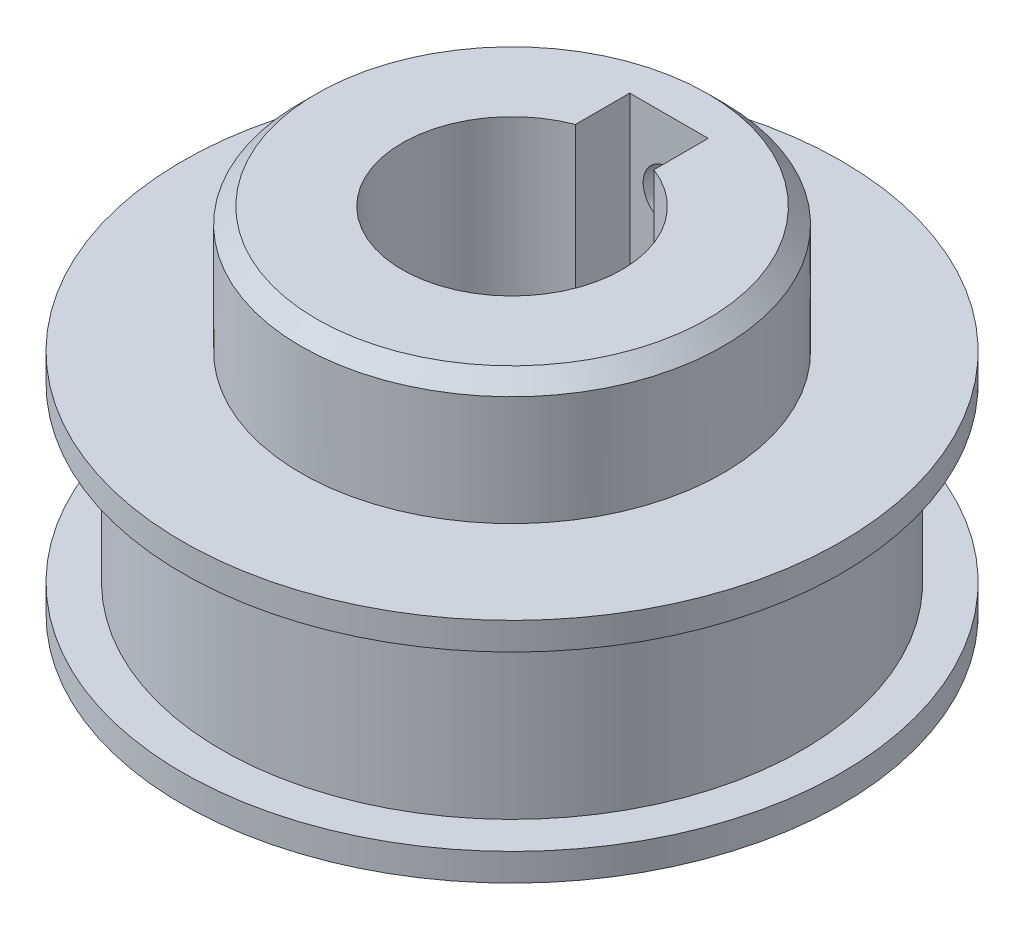
from build123d import *

# Parameters (mm, degrees)
SMUSSO1_SIZE             = 1
SCHIZZO2_R               = 6
TAGLIO_ESTRUSIONE1_DEPTH = 38.259227045
SCHIZZO3_R               = 1.65
TAGLIO_ESTRUSIONE2_DEPTH = 32.75787304
SCHIZZO4_R               = 7
TAGLIO_ESTRUSIONE3_DEPTH = 38.259227106
SCHIZZO5_W               = 5
SCHIZZO5_H               = 6
TAGLIO_ESTRUSIONE4_DEPTH = 38.259227106


with BuildPart() as part:
    # Schizzo1 → Rivoluzione1 (revolve)
    with BuildSketch(Plane.XY, mode=Mode.PRIVATE) as rivoluzione1_sk:
        Polygon((0, 11.25), (13.45, 11.25), (13.45, 3.25), (21, 3.25), (21, 1.5), (18.5, 1.5), (18.5, -9.5), (21, -9.5), (21, -11.25), (0, -11.25), align=None)
    revolve(rivoluzione1_sk.sketch.rotate(Axis((0, -12.375, 0), (0, 1, 0)), 90), axis=Axis((0, -12.375, 0), (0, 1, 0)))

    # Smusso1
    smusso1_edges = [part.edges().sort_by_distance(p)[0] for p in [
        (0, 11.25, 13.45),
    ]]
    chamfer(smusso1_edges, length=SMUSSO1_SIZE)

    # Schizzo2 → Taglio-Estrusione1 (cut, through all)
    with BuildSketch(Plane(origin=(0, 11.25, 0), x_dir=(1, 0, 0), z_dir=(0, 1, 0))):
        with Locations(Location((0, 0, 0), (0, 0, 270))):
            Circle(SCHIZZO2_R)
    extrude(amount=-TAGLIO_ESTRUSIONE1_DEPTH, mode=Mode.SUBTRACT)

    # Schizzo3 → Taglio-Estrusione2 (cut, through all)
    with BuildSketch(Plane.XY):
        with Locations((0, 6.75)):
            Circle(SCHIZZO3_R)
    extrude(amount=-TAGLIO_ESTRUSIONE2_DEPTH, mode=Mode.SUBTRACT)

    # Schizzo4 → Taglio-Estrusione3 (cut, through all)
    with BuildSketch(Plane(origin=(0, 11.25, 0), x_dir=(1, 0, 0), z_dir=(0, 1, 0))):
        with Locations(Location((0, 0, 0), (0, 0, 270))):
            Circle(SCHIZZO4_R)
    extrude(amount=-TAGLIO_ESTRUSIONE3_DEPTH, mode=Mode.SUBTRACT)

    # Schizzo5 → Taglio-Estrusione4 (cut, through all)
    with BuildSketch(Plane(origin=(0, 11.25, 0), x_dir=(1, 0, 0), z_dir=(0, 1, 0))):
        with Locations((0, 7)):
            Rectangle(SCHIZZO5_W, SCHIZZO5_H)
    extrude(amount=-TAGLIO_ESTRUSIONE4_DEPTH, mode=Mode.SUBTRACT)


solid = part.part
